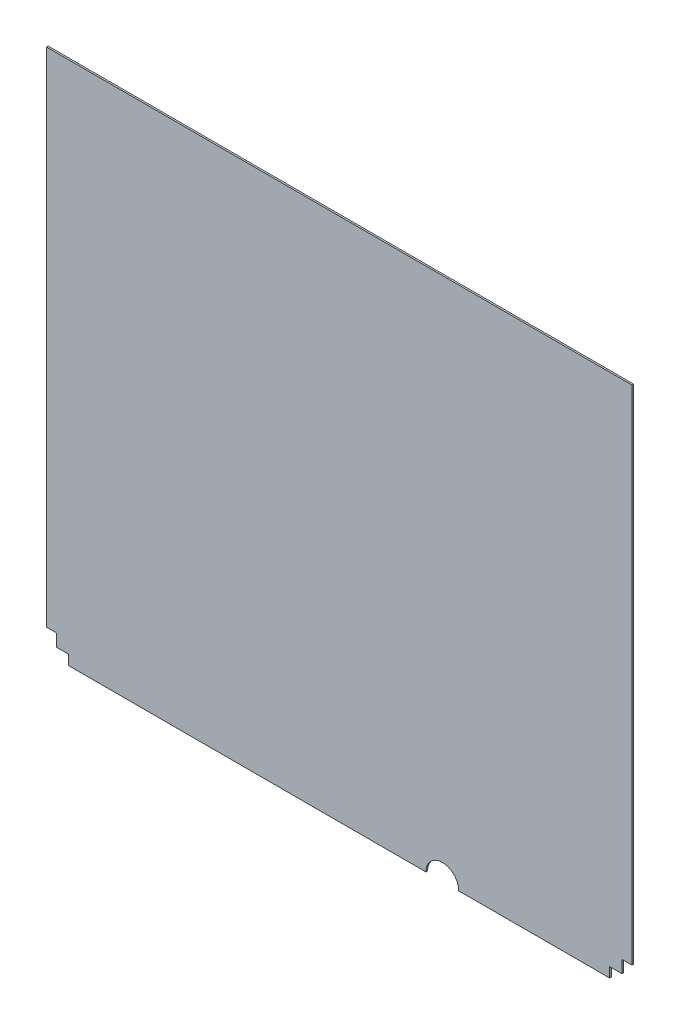
from build123d import *

# Parameters (mm, degrees)
BOSS_EXTRUDE1_DEPTH = 2.54


with BuildPart() as part:
    # Sketch1 → Boss-Extrude1 (new body)
    with BuildSketch(Plane.XY):
        with BuildLine():
            Line((0, 812.8), (0, 34.544))
            Line((0, 34.544), (15.24, 34.544))
            Line((15.24, 34.544), (15.24, 15.24))
            Line((15.24, 15.24), (34.544, 15.24))
            Line((34.544, 15.24), (34.544, 0))
            Line((34.544, 0), (587.904273944, 0))
            ThreePointArc((587.904273944, 0), (613.304273944, 25.4), (638.704273944, 0))
            Line((638.704273944, 0), (872.45698, 0))
            Line((872.45698, 0), (872.45698, 15.24))
            Line((872.45698, 15.24), (891.76098, 15.24))
            Line((891.76098, 15.24), (891.76098, 34.544))
            Line((891.76098, 34.544), (907.00098, 34.544))
            Line((907.00098, 34.544), (907.00098, 812.8))
            Line((907.00098, 812.8), (0, 812.8))
        make_face()
    extrude(amount=BOSS_EXTRUDE1_DEPTH)


solid = part.part
